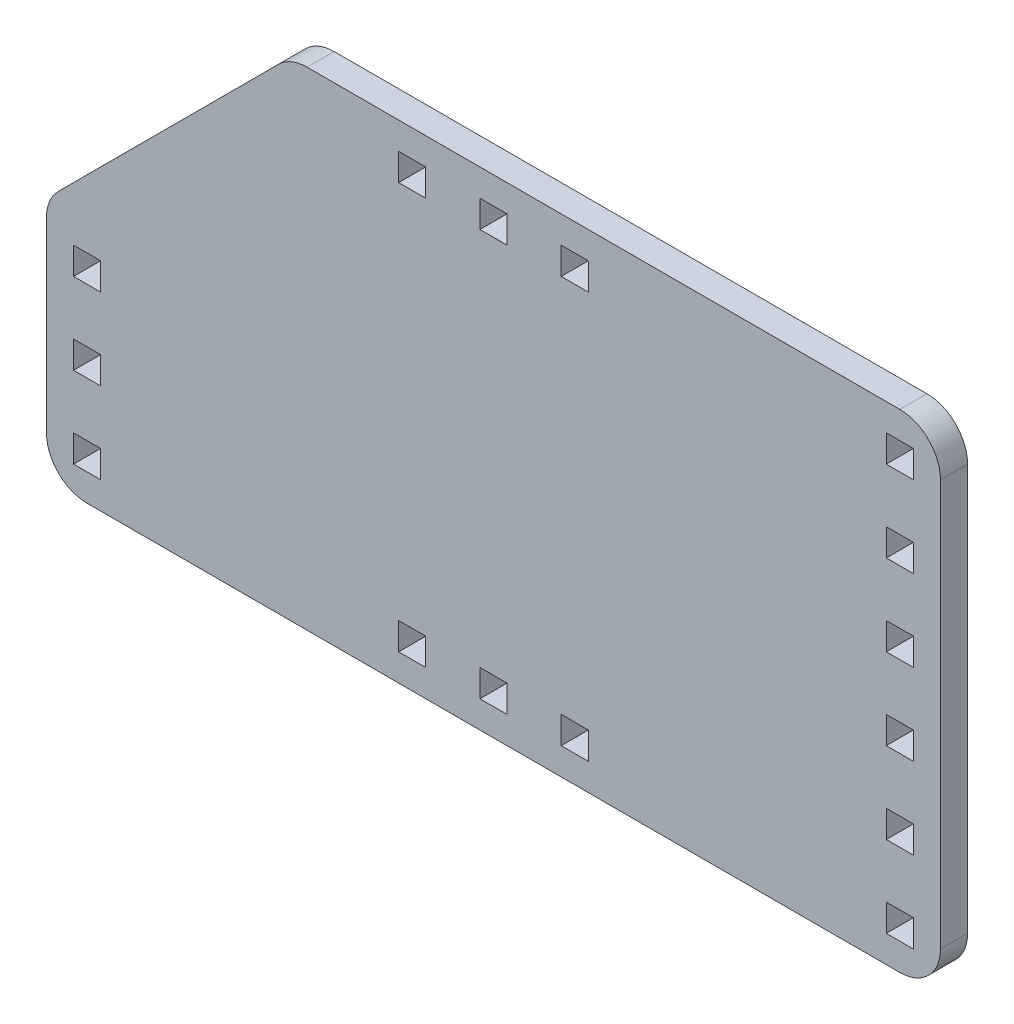
from build123d import *

# Parameters (mm, degrees)
MODEL_W                 = 3
MODEL_H                 = 3
SALIENTE_EXTRUIR1_DEPTH = 3


with BuildPart() as part:
    # Model → Saliente-Extruir1 (new body)
    with BuildSketch(Plane.XY):
        with BuildLine():
            Line((13.912774389, 239.757149551), (103.912774389, 239.757149551))
            ThreePointArc((103.912774389, 239.757149551), (107.094754904, 241.075169036), (108.412774389, 244.257149551))
            Line((108.412774389, 244.257149551), (108.412774389, 289.257149551))
            ThreePointArc((108.412774389, 289.257149551), (107.094754904, 292.439130067), (103.912774389, 293.757149551))
            Line((103.912774389, 293.757149551), (38.276735419, 293.757149551))
            ThreePointArc((38.276735419, 293.757149551), (36.554659974, 293.414607448), (35.094754904, 292.439130067))
            Line((35.094754904, 292.439130067), (10.730793873, 268.075169036))
            ThreePointArc((10.730793873, 268.075169036), (9.755316492, 266.615263966), (9.412774389, 264.893188521))
            Line((9.412774389, 264.893188521), (9.412774389, 244.257149551))
            ThreePointArc((9.412774389, 244.257149551), (10.730793873, 241.075169036), (13.912774389, 239.757149551))
        make_face()
        with Locations((13.912774389, 253.257149551)):
            Rectangle(MODEL_W, MODEL_H, mode=Mode.SUBTRACT)
        with Locations((103.912774389, 244.257149551)):
            Rectangle(MODEL_W, MODEL_H, mode=Mode.SUBTRACT)
        with Locations((103.912774389, 289.257149551)):
            Rectangle(MODEL_W, MODEL_H, mode=Mode.SUBTRACT)
        with Locations((58.912774389, 289.257149551)):
            Rectangle(MODEL_W, MODEL_H, mode=Mode.SUBTRACT)
        with Locations((103.912774389, 253.257149551)):
            Rectangle(MODEL_W, MODEL_H, mode=Mode.SUBTRACT)
        with Locations((103.912774389, 280.257149551)):
            Rectangle(MODEL_W, MODEL_H, mode=Mode.SUBTRACT)
        with Locations((67.912774389, 289.257149551)):
            Rectangle(MODEL_W, MODEL_H, mode=Mode.SUBTRACT)
        with Locations((49.912774389, 289.257149551)):
            Rectangle(MODEL_W, MODEL_H, mode=Mode.SUBTRACT)
        with Locations((103.912774389, 271.257149551)):
            Rectangle(MODEL_W, MODEL_H, mode=Mode.SUBTRACT)
        with Locations((103.912774389, 262.257149551)):
            Rectangle(MODEL_W, MODEL_H, mode=Mode.SUBTRACT)
        with Locations((58.912774389, 244.257149551)):
            Rectangle(MODEL_W, MODEL_H, mode=Mode.SUBTRACT)
        with Locations((67.912774389, 244.257149551)):
            Rectangle(MODEL_W, MODEL_H, mode=Mode.SUBTRACT)
        with Locations((49.912774389, 244.257149551)):
            Rectangle(MODEL_W, MODEL_H, mode=Mode.SUBTRACT)
        with Locations((13.912774389, 244.257149551)):
            Rectangle(MODEL_W, MODEL_H, mode=Mode.SUBTRACT)
        with Locations((13.912774389, 262.257149551)):
            Rectangle(MODEL_W, MODEL_H, mode=Mode.SUBTRACT)
    extrude(amount=SALIENTE_EXTRUIR1_DEPTH)


solid = part.part
